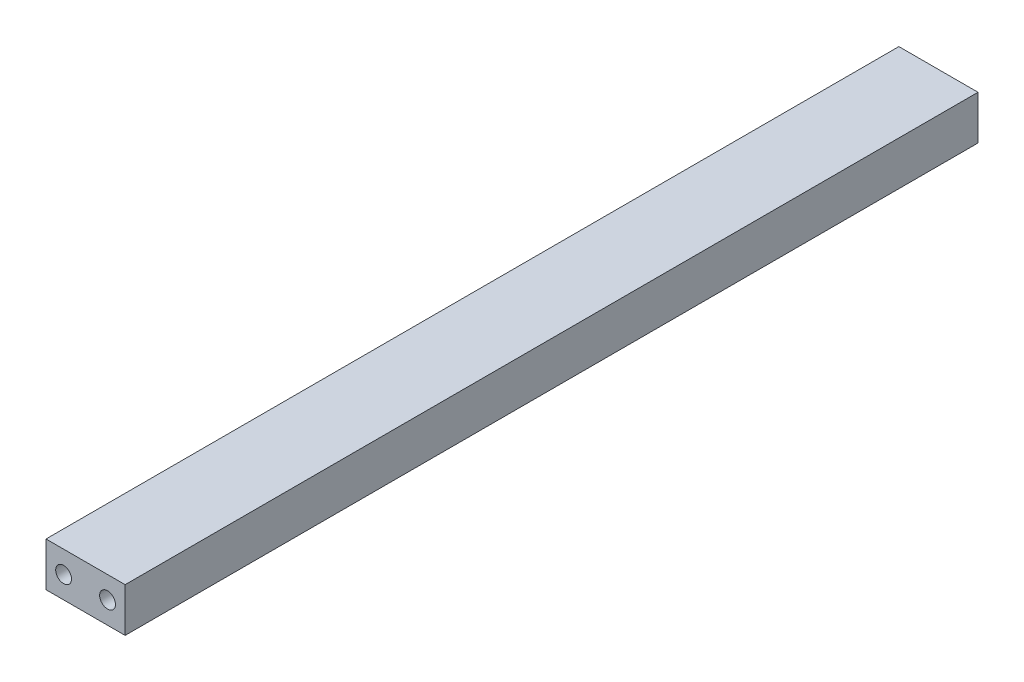
from build123d import *

# Parameters (mm, degrees)
SKETCH1_W           = 22.86
SKETCH1_H           = 12.7
SKETCH1_R           = 2.286
BOSS_EXTRUDE1_DEPTH = 246.38


with BuildPart() as part:
    # Sketch1 → Boss-Extrude1 (new body)
    with BuildSketch(Plane.XY):
        with Locations((11.43, 6.35)):
            Rectangle(SKETCH1_W, SKETCH1_H)
        with Locations((5.08, 6.35)):
            Circle(SKETCH1_R, mode=Mode.SUBTRACT)
        with Locations((17.78, 6.35)):
            Circle(SKETCH1_R, mode=Mode.SUBTRACT)
    extrude(amount=-BOSS_EXTRUDE1_DEPTH)


solid = part.part
